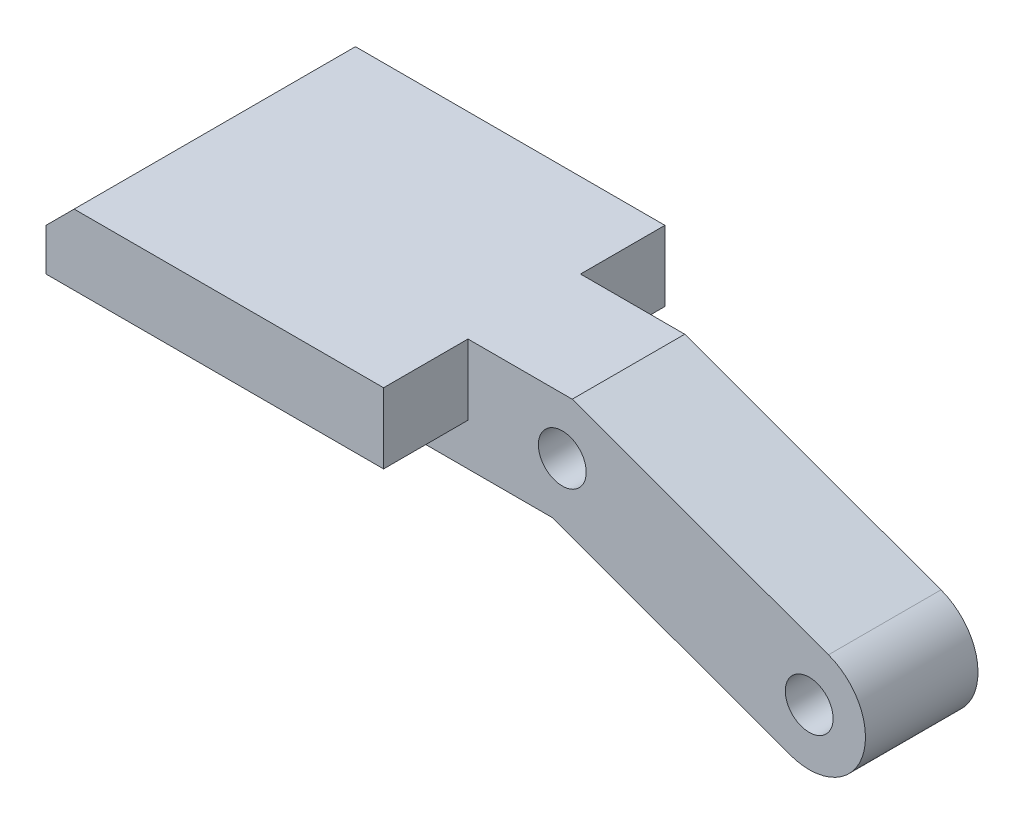
from build123d import *

# Parameters (mm, degrees)
EXTRUDE_1_DEPTH     = 8
SKETCH_2_R          = 1.7
CUT_EXTRUDE_1_DEPTH = 8
SKETCH_3_R          = 1.7
CUT_EXTRUDE_2_DEPTH = 8
SKETCH_4_W          = 24
SKETCH_4_H          = 20
EXTRUDE_2_DEPTH     = 5
CHAMFER_1_SIZE      = 2


with BuildPart() as part:
    # 草图1 → 凸台-拉伸1 (new body)
    with BuildSketch(Plane.XY):
        with BuildLine():
            Line((-1.368080573, -3.758770483), (-18.258766079, 2.388936277))
            Line((-18.258766079, 2.388936277), (-48.258766079, 2.388936277))
            Line((-48.258766079, 2.388936277), (-48.258766079, 10.388936277))
            Line((-48.258766079, 10.388936277), (-16.848150233, 10.388936277))
            Line((-16.848150233, 10.388936277), (1.368080573, 3.758770483))
            ThreePointArc((1.368080573, 3.758770483), (3.758770483, -1.368080573), (-1.368080573, -3.758770483))
        make_face()
    extrude(amount=EXTRUDE_1_DEPTH)

    # 草图2 → 切除-拉伸1 (cut)
    with BuildSketch(Plane.XY.offset(8)):
        Circle(SKETCH_2_R)
    extrude(amount=-CUT_EXTRUDE_1_DEPTH, mode=Mode.SUBTRACT)

    # 草图3 → 切除-拉伸2 (cut)
    with BuildSketch(Plane.XY.offset(8)):
        with Locations((-17.553458156, 6.388936277)):
            Circle(SKETCH_3_R)
    extrude(amount=-CUT_EXTRUDE_2_DEPTH, mode=Mode.SUBTRACT)

    # 草图4 → 凸台-拉伸2 (add)
    with BuildSketch(Plane(origin=(0, 10.388936277, 0), x_dir=(1, 0, 0), z_dir=(0, 1, 0))):
        with Locations((-36.258766079, -4)):
            Rectangle(SKETCH_4_W, SKETCH_4_H)
    extrude(amount=-EXTRUDE_2_DEPTH)

    # 倒角1
    chamfer_1_edges = [part.edges().sort_by_distance(p)[0] for p in [
        (-48.258766079, 10.388936277, 4),
    ]]
    chamfer(chamfer_1_edges, length=CHAMFER_1_SIZE)


solid = part.part
